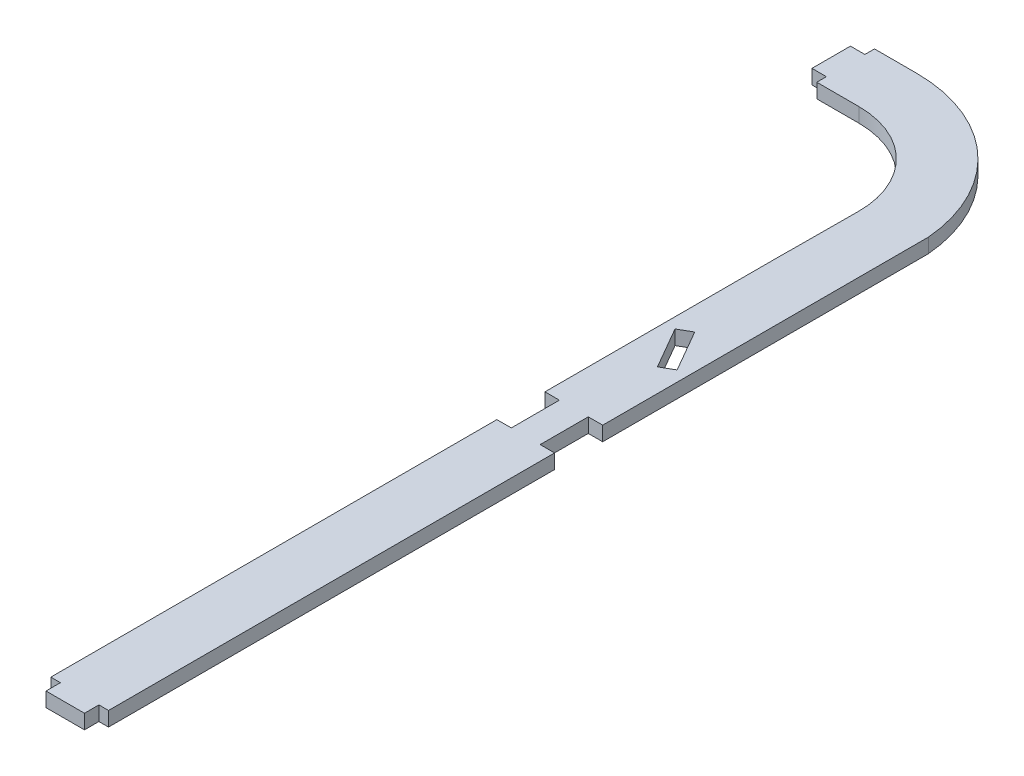
from build123d import *

# Parameters (mm, degrees)
SALIENTE_EXTRUIR1_DEPTH = 3


with BuildPart() as part:
    # Croquis1 → Saliente-Extruir1 (new body)
    with BuildSketch(Plane(origin=(0, 0, 0), x_dir=(1, 0, 0), z_dir=(0, 1, 0))):
        with BuildLine():
            Line((34.51, 4), (34.51, 0))
            Line((34.51, 0), (37.51, 0))
            Line((37.51, 0), (37.51, -2))
            Line((37.51, -2), (46.251262658, -2))
            ThreePointArc((46.251262658, -2), (59.584248365, -7.522703507), (65.106951872, -20.855689213))
            ThreePointArc((65.106951872, -20.855689213), (65.106606786, -20.969766147), (65.105571541, -21.083838906))
            Line((65.105571541, -21.083838906), (65, -38.533358743))
            Line((65, -38.533358743), (65, -86))
            Line((65, -86), (68, -86))
            Line((68, -86), (68, -96))
            Line((68, -96), (65, -96))
            Line((65, -96), (65, -117.736951872))
            Line((65, -117.736951872), (65, -188.736951872))
            Line((65, -188.736951872), (67, -188.736951872))
            Line((67, -188.736951872), (67, -191.736951872))
            Line((67, -191.736951872), (75, -191.736951872))
            Line((75, -191.736951872), (75, -188.736951872))
            Line((75, -188.736951872), (77, -188.736951872))
            Line((77, -188.736951872), (77, -96))
            Line((77, -96), (74, -96))
            Line((74, -96), (74, -86))
            Line((74, -86), (77, -86))
            Line((77, -86), (77, -64.74))
            Line((77, -64.74), (77, -38.533358743))
            Line((77, -38.533358743), (77, -23.422537226))
            Line((77, -23.422537226), (77, -18.2888412))
            ThreePointArc((77, -18.2888412), (67.142309691, 1.851968321), (46.251262658, 10))
            Line((46.251262658, 10), (37.51, 10))
            Line((37.51, 10), (37.51, 8))
            Line((37.51, 8), (34.51, 8))
            Line((34.51, 8), (34.51, 4))
        make_face()
        Polygon((67.200961894, -61.159872981), (69.799038106, -59.659872981), (74.799038106, -68.320127019), (72.200961894, -69.820127019), align=None, mode=Mode.SUBTRACT)
    extrude(amount=SALIENTE_EXTRUIR1_DEPTH)


solid = part.part
